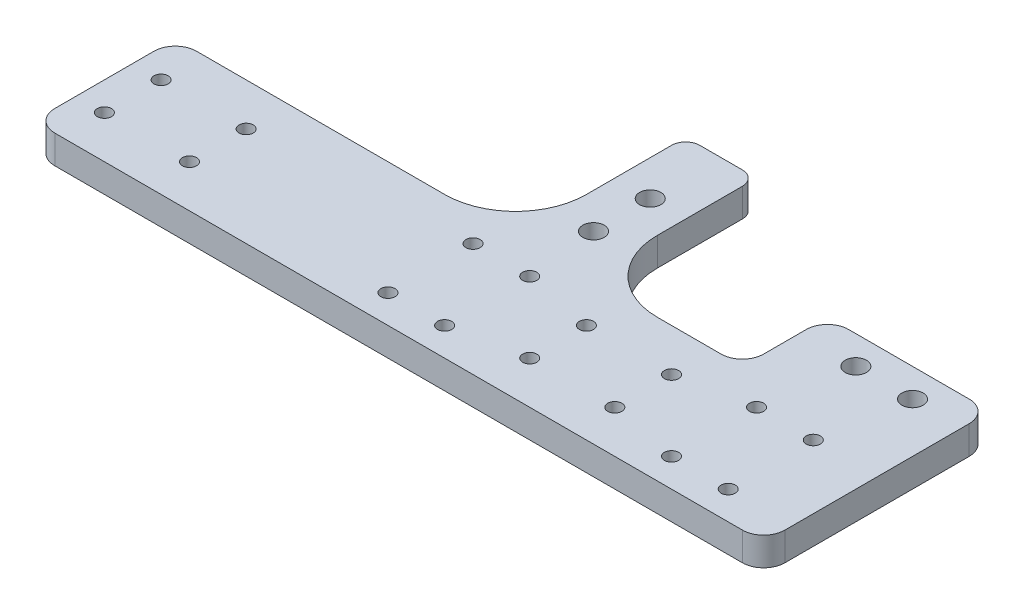
from build123d import *

# Parameters (mm, degrees)
SKETCH_1_W      = 80
SKETCH_1_H      = 20
SKETCH_1_R      = 1
SKETCH_1_W_2    = 23
SKETCH_1_H_2    = 12
SKETCH_1_R_2    = 1.5
EXTRUDE_1_DEPTH = 4
FILLET_1_R      = 3
SKETCH_2_W      = 10
SKETCH_2_H      = 24
SKETCH_2_R      = 1.5
EXTRUDE_2_DEPTH = 4
FILLET_2_R      = 10
FILLET_3_R      = 2


with BuildPart() as part:
    # 草图1 → 凸台-拉伸1 (new body)
    # profile 1 of 3: a face of its own
    with BuildSketch(Plane(origin=(0, 0, 0), x_dir=(1, 0, 0), z_dir=(0, 1, 0))):
        Rectangle(SKETCH_1_W, SKETCH_1_H)
        with Locations(Location((-36, -4, 0), (0, 0, 270))):
            Circle(SKETCH_1_R, mode=Mode.SUBTRACT)
        with Locations(Location((-24, -4, 0), (0, 0, 270))):
            Circle(SKETCH_1_R, mode=Mode.SUBTRACT)
        with Locations(Location((36, 4, 0), (0, 0, 270))):
            Circle(SKETCH_1_R, mode=Mode.SUBTRACT)
        with Locations(Location((24, 4, 0), (0, 0, 270))):
            Circle(SKETCH_1_R, mode=Mode.SUBTRACT)
        with Locations(Location((14, 6, 0), (0, 0, 270))):
            Circle(SKETCH_1_R, mode=Mode.SUBTRACT)
        with Locations(Location((6, 6, 0), (0, 0, 270))):
            Circle(SKETCH_1_R, mode=Mode.SUBTRACT)
        with Locations(Location((14, -6, 0), (0, 0, 270))):
            Circle(SKETCH_1_R, mode=Mode.SUBTRACT)
        with Locations(Location((6, -6, 0), (0, 0, 270))):
            Circle(SKETCH_1_R, mode=Mode.SUBTRACT)
        with Locations(Location((36, -4, 0), (0, 0, 270))):
            Circle(SKETCH_1_R, mode=Mode.SUBTRACT)
        with Locations(Location((24, -4, 0), (0, 0, 270))):
            Circle(SKETCH_1_R, mode=Mode.SUBTRACT)
        with Locations(Location((-36, 4, 0), (0, 0, 270))):
            Circle(SKETCH_1_R, mode=Mode.SUBTRACT)
        with Locations(Location((-24, 4, 0), (0, 0, 270))):
            Circle(SKETCH_1_R, mode=Mode.SUBTRACT)
    # profile 2 of 3: a face of its own
    with BuildSketch(Plane(origin=(0, 0, 0), x_dir=(1, 0, 0), z_dir=(0, 1, 0))):
        with Locations((51.5, 0)):
            Rectangle(SKETCH_1_W_2, SKETCH_1_H)
        with Locations(Location((46, -6, 0), (0, 0, 270))):
            Circle(SKETCH_1_R, mode=Mode.SUBTRACT)
        with Locations(Location((46, 6, 0), (0, 0, 270))):
            Circle(SKETCH_1_R, mode=Mode.SUBTRACT)
        with Locations(Location((54, -6, 0), (0, 0, 270))):
            Circle(SKETCH_1_R, mode=Mode.SUBTRACT)
        with Locations(Location((54, 6, 0), (0, 0, 270))):
            Circle(SKETCH_1_R, mode=Mode.SUBTRACT)
    # profile 3 of 3: a face of its own
    with BuildSketch(Plane(origin=(0, 0, 0), x_dir=(1, 0, 0), z_dir=(0, 1, 0))):
        with Locations((51.5, 16)):
            Rectangle(SKETCH_1_W_2, SKETCH_1_H_2)
        with Locations(Location((56, 18, 0), (0, 0, 270))):
            Circle(SKETCH_1_R_2, mode=Mode.SUBTRACT)
        with Locations(Location((48, 18, 0), (0, 0, 270))):
            Circle(SKETCH_1_R_2, mode=Mode.SUBTRACT)
    extrude(amount=EXTRUDE_1_DEPTH)

    # 圆角1
    fillet_1_edges = [part.edges().sort_by_distance(p)[0] for p in [
        (-40, 2, 10),
        (-40, 2, -10),
        (40, 2, -10),
        (40, 2, -22),
        (63, 2, -22),
        (63, 2, 10),
    ]]
    fillet(fillet_1_edges, radius=FILLET_1_R)

    # 草图2 → 凸台-拉伸2 (add)
    with BuildSketch(Plane(origin=(0, 4, 0), x_dir=(1, 0, 0), z_dir=(0, 1, 0))):
        with Locations((13, 22)):
            Rectangle(SKETCH_2_W, SKETCH_2_H)
        with Locations(Location((13, 24, 0), (0, 0, 270))):
            Circle(SKETCH_2_R, mode=Mode.SUBTRACT)
        with Locations(Location((13, 16, 0), (0, 0, 270))):
            Circle(SKETCH_2_R, mode=Mode.SUBTRACT)
    extrude(amount=-EXTRUDE_2_DEPTH)

    # 圆角2
    fillet_2_edges = [part.edges().sort_by_distance(p)[0] for p in [
        (18, 2, -10),
        (8, 2, -10),
    ]]
    fillet(fillet_2_edges, radius=FILLET_2_R)

    # 圆角3
    fillet_3_edges = [part.edges().sort_by_distance(p)[0] for p in [
        (8, 2, -34),
        (18, 2, -34),
    ]]
    fillet(fillet_3_edges, radius=FILLET_3_R)


solid = part.part
